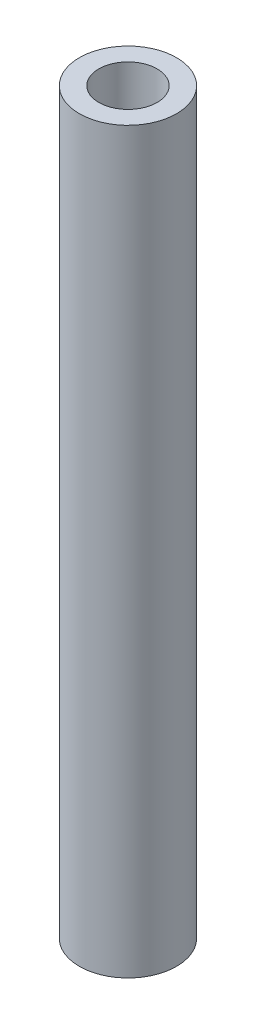
from build123d import *

# Parameters (mm, degrees)
SKETCH_1_R      = 2.5
SKETCH_1_R_2    = 1.5
EXTRUDE_1_DEPTH = 19


with BuildPart() as part:
    # 草图1 → 凸台-拉伸1 (new, symmetric)
    with BuildSketch(Plane(origin=(0, 0, 0), x_dir=(1, 0, 0), z_dir=(0, 1, 0))):
        with Locations(Location((0, 0, 0), (0, 0, 270))):
            Circle(SKETCH_1_R)
        with Locations(Location((0, 0, 0), (0, 0, 270))):
            Circle(SKETCH_1_R_2, mode=Mode.SUBTRACT)
    extrude(amount=EXTRUDE_1_DEPTH, both=True)


solid = part.part
